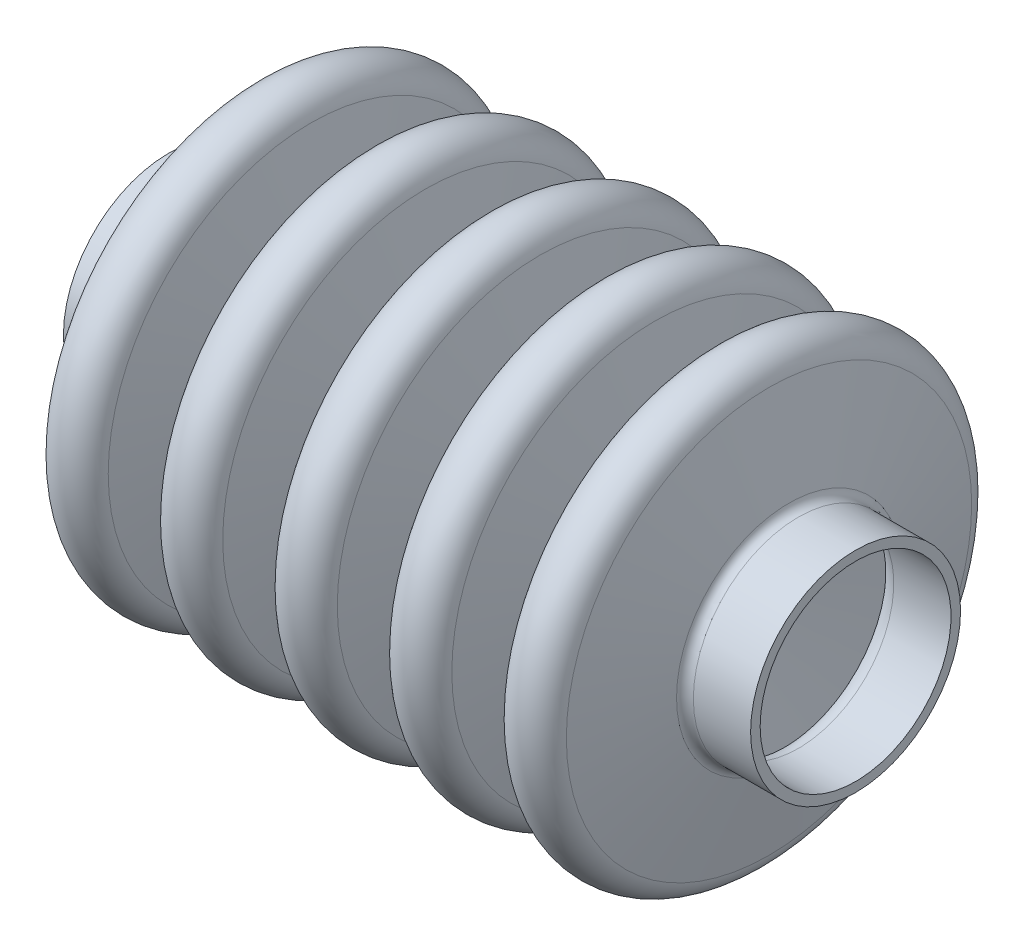
from build123d import *


with BuildPart() as part:
    # Sketch2 → Revolve1 (revolve)
    with BuildSketch(Plane(origin=(0, 0, 0), x_dir=(1, 0, 0), z_dir=(0, 1, 0)), mode=Mode.PRIVATE) as revolve1_sk:
        with BuildLine():
            ThreePointArc((-54, 11), (-53.374076528, 11.220115517), (-53.023703993, 11.783560386))
            Line((-53.023703993, 11.783560386), (-50.928888021, 21.232664602))
            ThreePointArc((-50.928888021, 21.232664602), (-48, 23.583345761), (-45.071111979, 21.232664602))
            Line((-45.071111979, 21.232664602), (-42.976296007, 11.783560386))
            ThreePointArc((-42.976296007, 11.783560386), (-42.625923472, 11.220115517), (-42, 11))
            Line((-42, 11), (-42, 10))
            ThreePointArc((-42, 10), (-43.251846944, 10.440231034), (-43.952592014, 11.567120772))
            Line((-43.952592014, 11.567120772), (-46.047407986, 21.016224988))
            ThreePointArc((-46.047407986, 21.016224988), (-48, 22.583345761), (-49.952592014, 21.016224988))
            Line((-49.952592014, 21.016224988), (-52.047407986, 11.567120772))
            ThreePointArc((-52.047407986, 11.567120772), (-52.748153056, 10.440231034), (-54, 10))
            Line((-54, 10), (-54, 11))
        make_face()
        with BuildLine():
            ThreePointArc((-66, 11), (-65.374076528, 11.220115517), (-65.023703993, 11.783560386))
            Line((-65.023703993, 11.783560386), (-62.928888021, 21.232664602))
            ThreePointArc((-62.928888021, 21.232664602), (-60, 23.583345761), (-57.071111979, 21.232664602))
            Line((-57.071111979, 21.232664602), (-54.976296007, 11.783560386))
            ThreePointArc((-54.976296007, 11.783560386), (-54.625923472, 11.220115517), (-54, 11))
            Line((-54, 11), (-54, 10))
            ThreePointArc((-54, 10), (-55.251846944, 10.440231034), (-55.952592014, 11.567120772))
            Line((-55.952592014, 11.567120772), (-58.047407986, 21.016224988))
            ThreePointArc((-58.047407986, 21.016224988), (-60, 22.583345761), (-61.952592014, 21.016224988))
            Line((-61.952592014, 21.016224988), (-64.047407986, 11.567120772))
            ThreePointArc((-64.047407986, 11.567120772), (-64.748153056, 10.440231034), (-66, 10))
            Line((-66, 10), (-72, 10))
            Line((-72, 10), (-72, 11))
            Line((-72, 11), (-66, 11))
        make_face()
        with BuildLine():
            ThreePointArc((-30, 11), (-29.374076528, 11.220115517), (-29.023703993, 11.783560386))
            Line((-29.023703993, 11.783560386), (-26.928888021, 21.232664602))
            ThreePointArc((-26.928888021, 21.232664602), (-24, 23.583345761), (-21.071111979, 21.232664602))
            Line((-21.071111979, 21.232664602), (-18.976296007, 11.783560386))
            ThreePointArc((-18.976296007, 11.783560386), (-18.625923472, 11.220115517), (-18, 11))
            Line((-18, 11), (-18, 10))
            ThreePointArc((-18, 10), (-19.251846944, 10.440231034), (-19.952592014, 11.567120772))
            Line((-19.952592014, 11.567120772), (-22.047407986, 21.016224988))
            ThreePointArc((-22.047407986, 21.016224988), (-24, 22.583345761), (-25.952592014, 21.016224988))
            Line((-25.952592014, 21.016224988), (-28.047407986, 11.567120772))
            ThreePointArc((-28.047407986, 11.567120772), (-28.748153056, 10.440231034), (-30, 10))
            Line((-30, 10), (-30, 11))
        make_face()
        with BuildLine():
            ThreePointArc((-42, 11), (-41.374076528, 11.220115517), (-41.023703993, 11.783560386))
            Line((-41.023703993, 11.783560386), (-38.928888021, 21.232664602))
            ThreePointArc((-38.928888021, 21.232664602), (-36, 23.583345761), (-33.071111979, 21.232664602))
            Line((-33.071111979, 21.232664602), (-30.976296007, 11.783560386))
            ThreePointArc((-30.976296007, 11.783560386), (-30.625923472, 11.220115517), (-30, 11))
            Line((-30, 11), (-30, 10))
            ThreePointArc((-30, 10), (-31.251846944, 10.440231034), (-31.952592014, 11.567120772))
            Line((-31.952592014, 11.567120772), (-34.047407986, 21.016224988))
            ThreePointArc((-34.047407986, 21.016224988), (-36, 22.583345761), (-37.952592014, 21.016224988))
            Line((-37.952592014, 21.016224988), (-40.047407986, 11.567120772))
            ThreePointArc((-40.047407986, 11.567120772), (-40.748153056, 10.440231034), (-42, 10))
            Line((-42, 10), (-42, 11))
        make_face()
        with BuildLine():
            ThreePointArc((-18, 11), (-17.374076528, 11.220115517), (-17.023703993, 11.783560386))
            Line((-17.023703993, 11.783560386), (-14.928888021, 21.232664602))
            ThreePointArc((-14.928888021, 21.232664602), (-12, 23.583345761), (-9.071111979, 21.232664602))
            Line((-9.071111979, 21.232664602), (-6.976296007, 11.783560386))
            ThreePointArc((-6.976296007, 11.783560386), (-6.625923472, 11.220115517), (-6, 11))
            Line((-6, 11), (0, 11))
            Line((0, 11), (0, 10))
            Line((0, 10), (-6, 10))
            ThreePointArc((-6, 10), (-7.251846944, 10.440231034), (-7.952592014, 11.567120772))
            Line((-7.952592014, 11.567120772), (-10.047407986, 21.016224988))
            ThreePointArc((-10.047407986, 21.016224988), (-12, 22.583345761), (-13.952592014, 21.016224988))
            Line((-13.952592014, 21.016224988), (-16.047407986, 11.567120772))
            ThreePointArc((-16.047407986, 11.567120772), (-16.748153056, 10.440231034), (-18, 10))
            Line((-18, 10), (-18, 11))
        make_face()
    revolve(revolve1_sk.sketch.rotate(Axis((0, 0, 0), (1, 0, 0)), 180), axis=Axis((0, 0, 0), (1, 0, 0)))


solid = part.part
